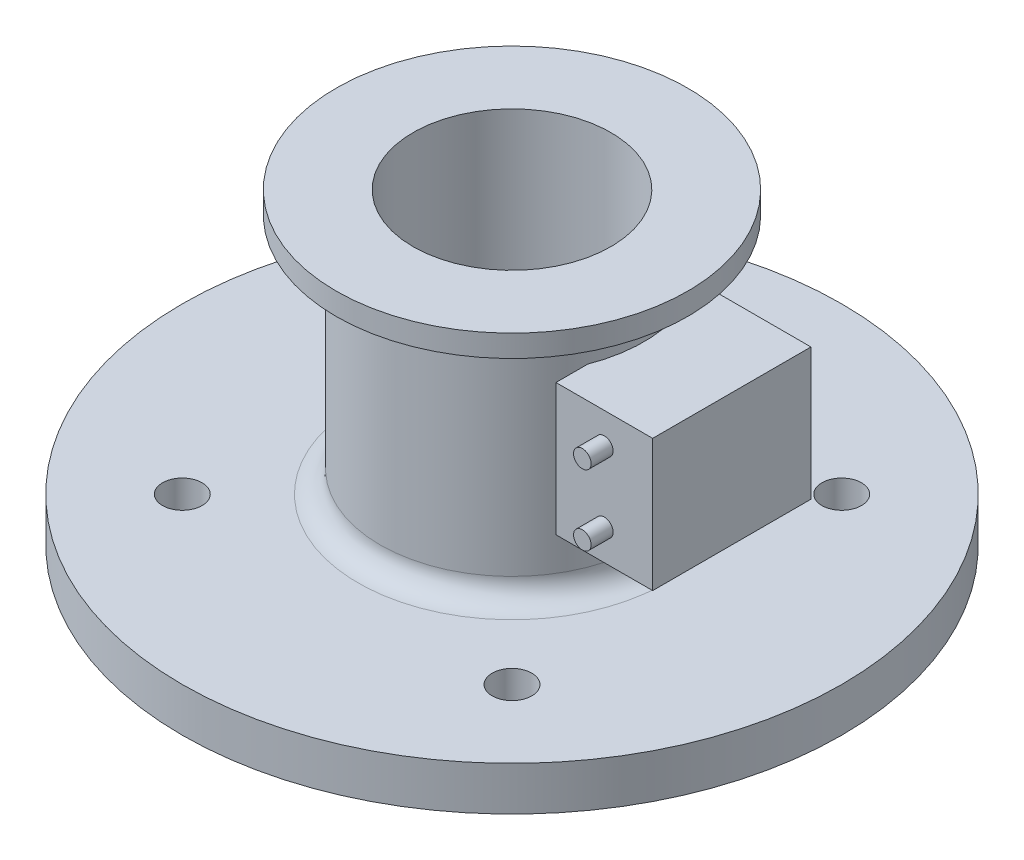
from build123d import *

# Parameters (mm, degrees)
IZIM1_W                     = 100
IZIM1_H                     = 100
IZIM1_R                     = 4.5
Y_KSEKLIK_EKSTR_ZYON1_DEPTH = 10
IZIM3_R                     = 30
IZIM3_R_2                   = 22.5
Y_KSEKLIK_EKSTR_ZYON2_DEPTH = 60
Y_KSEKLIK_EKSTR_ZYON3_START = -5
IZIM4_R                     = 40
IZIM4_R_2                   = 30
Y_KSEKLIK_EKSTR_ZYON3_DEPTH = 5
RADYUS1_R                   = 5
Y_KSEKLIK_EKSTR_ZYON4_START = 40
IZIM5_W                     = 22
IZIM5_H                     = 36
Y_KSEKLIK_EKSTR_ZYON4_DEPTH = 15
IZIM6_R                     = 2
Y_KSEKLIK_EKSTR_ZYON5_DEPTH = 5
Y_KSEKLIK_EKSTR_ZYON6_START = 10
IZIM7_R                     = 75
Y_KSEKLIK_EKSTR_ZYON6_DEPTH = 10


with BuildPart() as part:
    # Çizim1 → Yükseklik-Ekstrüzyon1 (new body)
    with BuildSketch(Plane(origin=(0, 0, 0), x_dir=(1, 0, 0), z_dir=(0, 1, 0))):
        Rectangle(IZIM1_W, IZIM1_H)
        with Locations(Location((-37.5, 37.5, 0), (0, 0, 270))):
            Circle(IZIM1_R, mode=Mode.SUBTRACT)
        with Locations(Location((37.5, 37.5, 0), (0, 0, 270))):
            Circle(IZIM1_R, mode=Mode.SUBTRACT)
        with Locations(Location((37.5, -37.5, 0), (0, 0, 270))):
            Circle(IZIM1_R, mode=Mode.SUBTRACT)
        with Locations(Location((-37.5, -37.5, 0), (0, 0, 270))):
            Circle(IZIM1_R, mode=Mode.SUBTRACT)
    extrude(amount=Y_KSEKLIK_EKSTR_ZYON1_DEPTH)

    # Çizim3 → Yükseklik-Ekstrüzyon2 (add)
    with BuildSketch(Plane(origin=(0, 10, 0), x_dir=(1, 0, 0), z_dir=(0, 1, 0))):
        with Locations(Location((0, 0, 0), (0, 0, 90))):
            Circle(IZIM3_R)
        with Locations(Location((0, 0, 0), (0, 0, 270))):
            Circle(IZIM3_R_2, mode=Mode.SUBTRACT)
    extrude(amount=Y_KSEKLIK_EKSTR_ZYON2_DEPTH)

    # Çizim4 → Yükseklik-Ekstrüzyon3 (add)
    with BuildSketch(Plane(origin=(0, 70, 0), x_dir=(1, 0, 0), z_dir=(0, 1, 0)).offset(Y_KSEKLIK_EKSTR_ZYON3_START)):
        with Locations(Location((0, 0, 0), (0, 0, 270))):
            Circle(IZIM4_R)
        with Locations(Location((0, 0, 0), (0, 0, 90))):
            Circle(IZIM4_R_2, mode=Mode.SUBTRACT)
    extrude(amount=Y_KSEKLIK_EKSTR_ZYON3_DEPTH)

    # Radyus1
    radyus1_edges = [part.edges().sort_by_distance(p)[0] for p in [
        (0, 10, 30),
        (0, 65, 30),
        (50, 5, 50),
        (-50, 5, 50),
        (-50, 5, -50),
        (50, 5, -50),
    ]]
    fillet(radyus1_edges, radius=RADYUS1_R)

    # Çizim7 → Yükseklik-Ekstrüzyon6 (add)
    with BuildSketch(Plane(origin=(0, 0, 0), x_dir=(1, 0, 0), z_dir=(0, 1, 0)).offset(Y_KSEKLIK_EKSTR_ZYON6_START)):
        with Locations(Location((0, 0, 0), (0, 0, 270))):
            Circle(IZIM7_R)
        with BuildLine():
            Line((45, 50), (-45, 50))
            ThreePointArc((-45, 50), (-48.535533906, 48.535533906), (-50, 45))
            Line((-50, 45), (-50, -45))
            ThreePointArc((-50, -45), (-48.535533906, -48.535533906), (-45, -50))
            Line((-45, -50), (45, -50))
            ThreePointArc((45, -50), (48.535533906, -48.535533906), (50, -45))
            Line((50, -45), (50, 45))
            ThreePointArc((50, 45), (48.535533906, 48.535533906), (45, 50))
        make_face(mode=Mode.SUBTRACT)
    extrude(amount=-Y_KSEKLIK_EKSTR_ZYON6_DEPTH)


with BuildPart() as body_2:
    # Çizim5 → Yükseklik-Ekstrüzyon4 (new, symmetric)
    with BuildSketch(Plane(origin=(0, 0, 0), x_dir=(1, 0, 0), z_dir=(0, 1, 0)).offset(Y_KSEKLIK_EKSTR_ZYON4_START)):
        with Locations((39, 0)):
            Rectangle(IZIM5_W, IZIM5_H)
    extrude(amount=Y_KSEKLIK_EKSTR_ZYON4_DEPTH, both=True)

    # Çizim6 → Yükseklik-Ekstrüzyon5 (add)
    with BuildSketch(Plane.XY.offset(18)):
        with Locations(Location((39, 48, 0), (0, 0, 180))):
            Circle(IZIM6_R)
        with Locations(Location((39, 32, 0), (0, 0, 180))):
            Circle(IZIM6_R)
    extrude(amount=Y_KSEKLIK_EKSTR_ZYON5_DEPTH)


solid = Compound([part.part, body_2.part])
